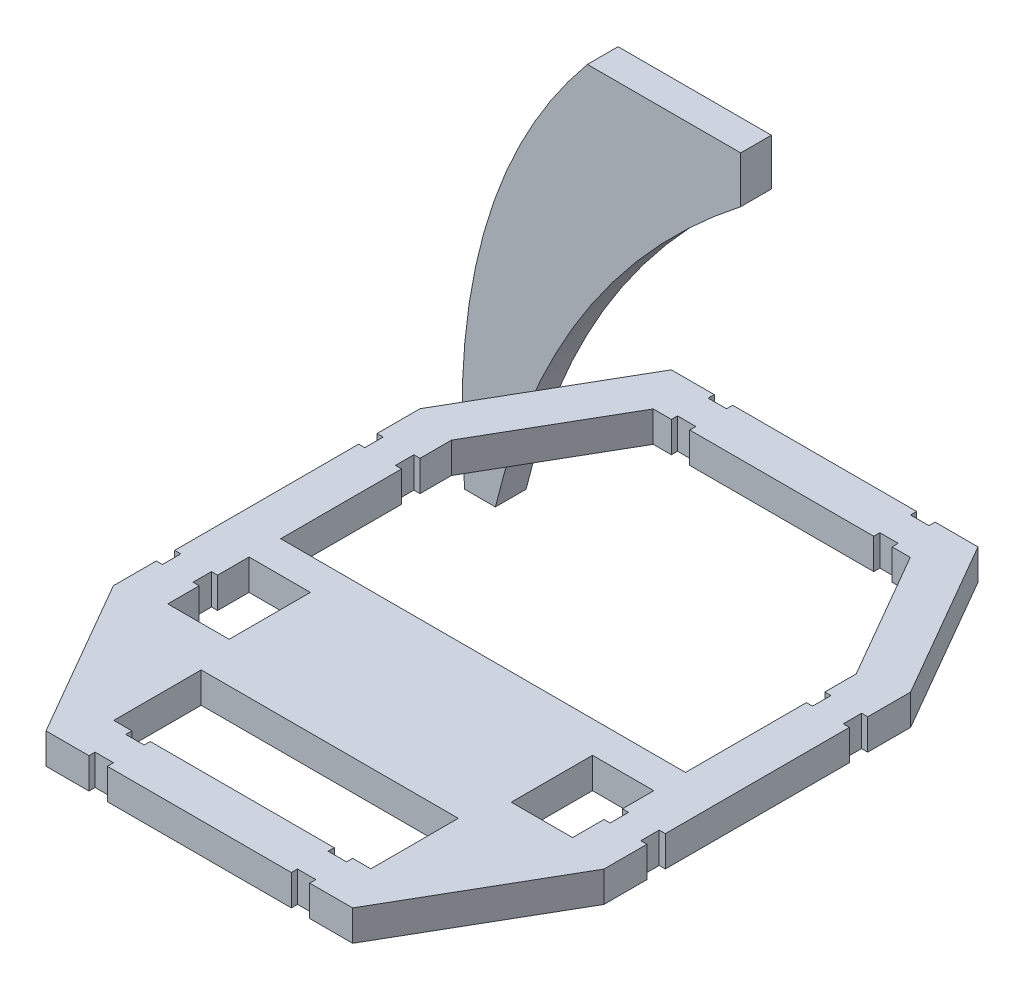
from build123d import *

# Parameters (mm, degrees)
FOOT_DEPTH                       = 5
FEET_BASE_W_BATTERY_HOLDER_DEPTH = 5


with BuildPart() as part:
    # Esquisse1 → Foot (new body)
    with BuildSketch(Plane.XY):
        with BuildLine():
            Line((-89.395324531, 0), (-64.395324531, 0))
            Line((-64.395324531, 0), (-64.395324531, -7.6))
            add(Edge.make_bspline(
                [(-104.395324531, -70), (-95.305016455, -31.745468269), (-64.395324531, -7.6)],
                knots=[0, 0, 0, 1, 1, 1], degree=2))
            Line((-104.395324531, -70), (-109.395324531, -70))
            add(Edge.make_bspline(
                [(-89.395324531, 0), (-112.89262364, -28.444226906), (-109.395324531, -70)],
                knots=[0, 0, 0, 1, 1, 1], degree=2))
        make_face()
    extrude(amount=FOOT_DEPTH)


with BuildPart() as body_2:
    # Feet base w/ battery → Feet base w/battery holder (new body)
    with BuildSketch(Plane(origin=(0, 0, 0), x_dir=(1, 0, 0), z_dir=(0, 1, 0))):
        Polygon((-34.421633158, -148.248178954), (-27.421633158, -148.248178954), (-27.421633158, -147.248178954), (-24.421633158, -147.248178954), (-24.421633158, -148.248178954), (5.578366842, -148.248178954), (5.578366842, -147.248178954), (8.578366842, -147.248178954), (8.578366842, -148.248178954), (15.578366842, -148.248178954), (30.578366842, -122.267416841), (30.578366842, -115.267416841), (29.578366842, -115.267416841), (29.578366842, -112.267416841), (30.578366842, -112.267416841), (30.578366842, -82.267416841), (29.578366842, -82.267416841), (29.578366842, -79.267416841), (30.578366842, -79.267416841), (30.578366842, -72.267416841), (15.578366842, -46.286654727), (8.578366842, -46.286654727), (8.578366842, -47.286654727), (5.578366842, -47.286654727), (5.578366842, -46.286654727), (-24.421633158, -46.286654727), (-24.421633158, -47.286654727), (-27.421633158, -47.286654727), (-27.421633158, -46.286654727), (-34.421633158, -46.286654727), (-49.421633158, -72.267416841), (-49.421633158, -79.267416841), (-48.421633158, -79.267416841), (-48.421633158, -82.267416841), (-49.421633158, -82.267416841), (-49.421633158, -112.267416841), (-48.421633158, -112.267416841), (-48.421633158, -115.267416841), (-49.421633158, -115.267416841), (-49.421633158, -122.267416841), align=None)
        Polygon((-42.421633158, -115.267416841), (-42.421633158, -120.391772494), (-32.421633158, -120.391772494), (-32.421633158, -107.143061191), (-42.421633158, -107.143061191), (-42.421633158, -112.267416841), (-43.421633158, -112.267416841), (-43.421633158, -115.267416841), align=None, mode=Mode.SUBTRACT)
        Polygon((-42.421633158, -74.143061188), (-42.421633158, -79.267416841), (-43.421633158, -79.267416841), (-43.421633158, -82.267416841), (-42.421633158, -82.267416841), (-42.421633158, -101.984623152), (23.578366842, -101.984623152), (23.578366842, -82.267416841), (24.578366842, -82.267416841), (24.578366842, -79.267416841), (23.578366842, -79.267416841), (23.578366842, -74.143061188), (11.536914958, -53.286654727), (8.578366842, -53.286654727), (8.578366842, -52.286654727), (5.578366842, -52.286654727), (5.578366842, -53.286654727), (-24.421633158, -53.286654727), (-24.421633158, -52.286654727), (-27.421633158, -52.286654727), (-27.421633158, -53.286654727), (-30.380181274, -53.286654727), align=None, mode=Mode.SUBTRACT)
        Polygon((23.578366842, -120.391772494), (23.578366842, -115.267416841), (24.578366842, -115.267416841), (24.578366842, -112.267416841), (23.578366842, -112.267416841), (23.578366842, -107.143061191), (13.578366842, -107.143061191), (13.578366842, -120.391772494), align=None, mode=Mode.SUBTRACT)
        Polygon((8.578366842, -141.248178954), (11.536914958, -141.248178954), (11.536914958, -126.984623152), (-30.380181274, -126.984623152), (-30.380181274, -141.248178954), (-27.421633158, -141.248178954), (-27.421633158, -142.248178954), (-24.421633158, -142.248178954), (-24.421633158, -141.248178954), (5.578366842, -141.248178954), (5.578366842, -142.248178954), (8.578366842, -142.248178954), align=None, mode=Mode.SUBTRACT)
    extrude(amount=FEET_BASE_W_BATTERY_HOLDER_DEPTH)


solid = Compound([part.part, body_2.part])
